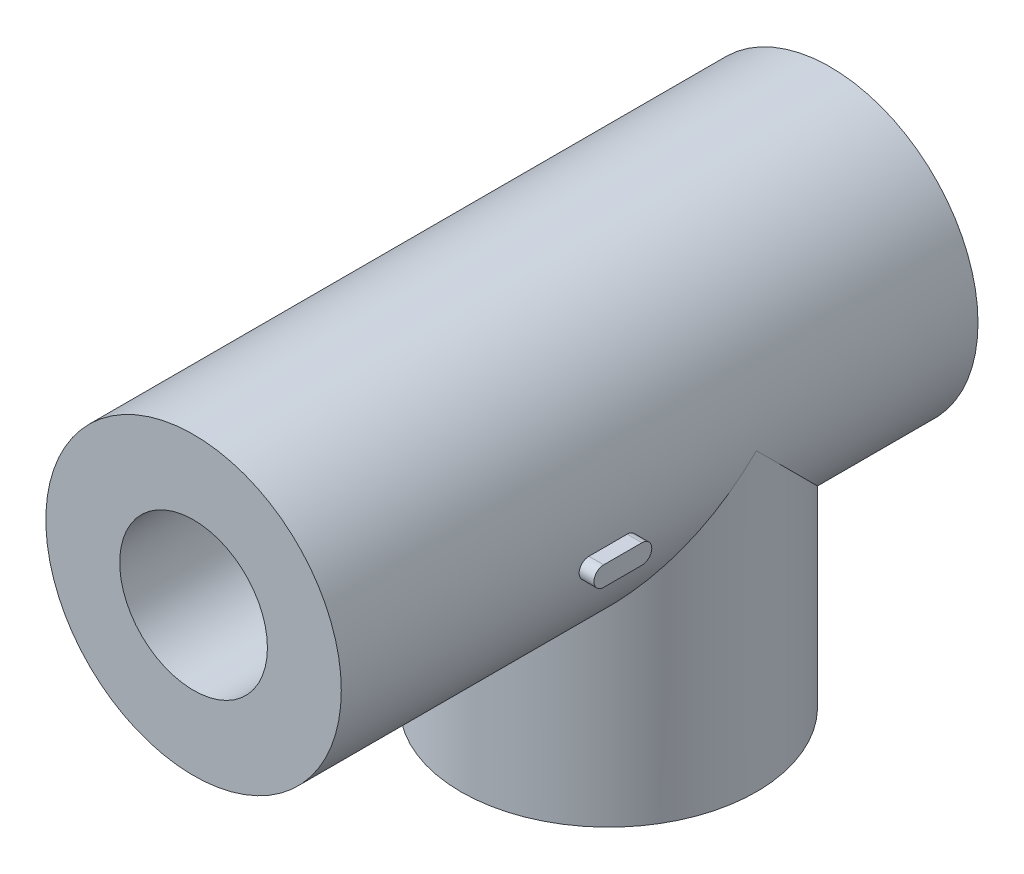
from build123d import *

# Parameters (mm, degrees)
SKETCH1_R           = 20
BOSS_EXTRUDE1_DEPTH = 86.2
SKETCH4_R           = 20
BOSS_EXTRUDE2_DEPTH = 40
SKETCH5_R           = 10
CUT_EXTRUDE1_DEPTH  = 20
SKETCH6_R           = 10
CUT_EXTRUDE2_DEPTH  = 20
BOSS_EXTRUDE3_DEPTH = 2


with BuildPart() as part:
    # Sketch1 → Boss-Extrude1 (new body)
    with BuildSketch(Plane.XY):
        Circle(SKETCH1_R)
    extrude(amount=BOSS_EXTRUDE1_DEPTH)

    # Sketch4 → Boss-Extrude2 (add)
    with BuildSketch(Plane(origin=(0, 0, 0), x_dir=(1, 0, 0), z_dir=(0, 1, 0))):
        with Locations(Location((0, -30, 0), (0, 0, 270))):
            Circle(SKETCH4_R)
    extrude(amount=-BOSS_EXTRUDE2_DEPTH)

    # Sketch5 → Cut-Extrude1 (cut)
    with BuildSketch(Plane.XZ.offset(40)):
        with Locations(Location((0, 30, 0), (0, 0, 270))):
            Circle(SKETCH5_R)
    extrude(amount=-CUT_EXTRUDE1_DEPTH, mode=Mode.SUBTRACT)

    # Sketch6 → Cut-Extrude2 (cut)
    with BuildSketch(Plane.XY.offset(86.2)):
        Circle(SKETCH6_R)
    extrude(amount=-CUT_EXTRUDE2_DEPTH, mode=Mode.SUBTRACT)


with BuildPart() as body_2:
    # Sketch7 → Boss-Extrude3 (new body)
    with BuildSketch(Plane(origin=(20, 0, 0), x_dir=(0, 0, -1), z_dir=(1, 0, 0))):
        with BuildLine():
            Line((-52.675133912, -1.038052004), (-47.486637704, -1.038052004))
            ThreePointArc((-47.486637704, -1.038052004), (-46.165929578, -2.358760129), (-47.486637704, -3.679468255))
            Line((-47.486637704, -3.679468255), (-52.675133912, -3.679468255))
            ThreePointArc((-52.675133912, -3.679468255), (-53.995842038, -2.358760129), (-52.675133912, -1.038052004))
        make_face()
    extrude(amount=BOSS_EXTRUDE3_DEPTH)


solid = Compound([part.part, body_2.part])
